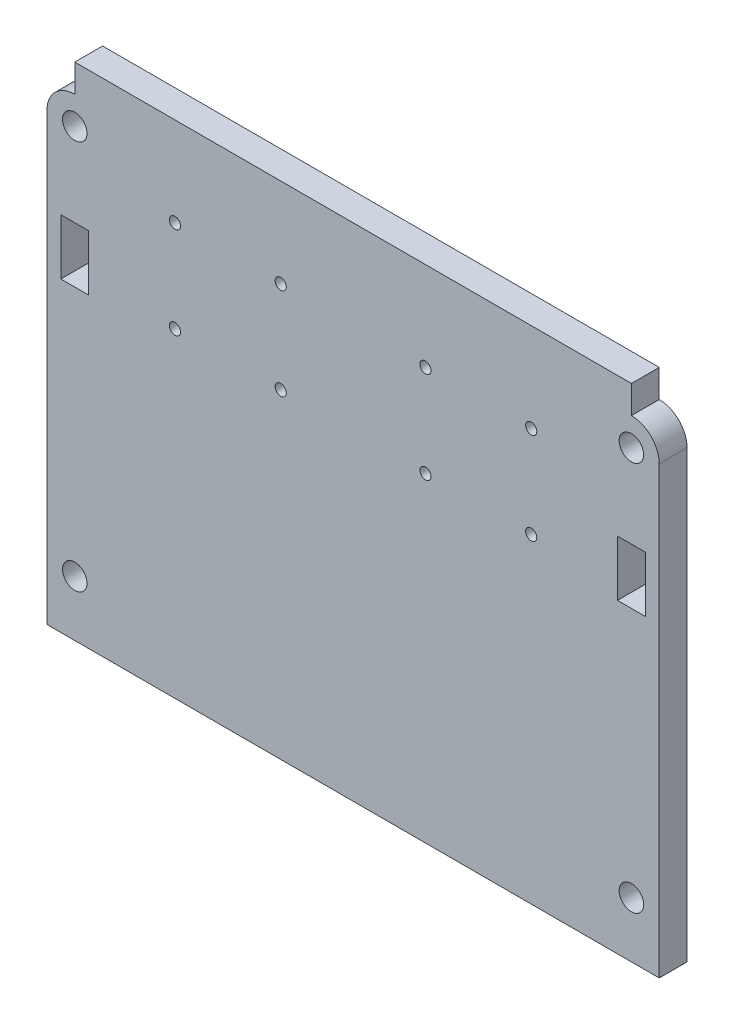
from build123d import *

# Parameters (mm, degrees)
SKETCH1_R           = 2.2
BOSS_EXTRUDE1_DEPTH = 5
SKETCH2_R           = 1
CUT_EXTRUDE1_DEPTH  = 153.151240547


with BuildPart() as part:
    # Sketch1 → Boss-Extrude1 (new body)
    with BuildSketch(Plane.XY):
        with BuildLine():
            Line((0, 105), (0, 110))
            Line((0, 110), (100, 110))
            Line((100, 110), (100, 105))
            ThreePointArc((100, 105), (103.535533906, 103.535533906), (105, 100))
            Line((105, 100), (105, 20))
            Line((105, 20), (100, 20))
            Line((100, 20), (0, 20))
            Line((0, 20), (-5, 20))
            Line((-5, 20), (-5, 100))
            ThreePointArc((-5, 100), (-3.535533906, 103.535533906), (0, 105))
        make_face()
        with Locations((0, 100)):
            Circle(SKETCH1_R, mode=Mode.SUBTRACT)
        with Locations((0, 30)):
            Circle(SKETCH1_R, mode=Mode.SUBTRACT)
        with Locations(Location((100, 30, 0), (0, 0, 180))):
            Circle(SKETCH1_R, mode=Mode.SUBTRACT)
        with Locations(Location((100, 100, 0), (0, 0, 180))):
            Circle(SKETCH1_R, mode=Mode.SUBTRACT)
        Polygon((0, 85), (2.5, 85), (2.5, 75), (0, 75), (-2.5, 75), (-2.5, 85), align=None, mode=Mode.SUBTRACT)
        Polygon((102.5, 75), (100, 75), (97.5, 75), (97.5, 85), (100, 85), (102.5, 85), align=None, mode=Mode.SUBTRACT)
    extrude(amount=BOSS_EXTRUDE1_DEPTH)

    # Sketch2 → Cut-Extrude1 (cut, through all)
    with BuildSketch(Plane.XY.offset(5)):
        with Locations((18, 94)):
            Circle(SKETCH2_R)
        with Locations((37, 94)):
            Circle(SKETCH2_R)
        with Locations((18, 77.5)):
            Circle(SKETCH2_R)
        with Locations((37, 77.5)):
            Circle(SKETCH2_R)
        with Locations(Location((63, 77.5, 0), (0, 0, 180))):
            Circle(SKETCH2_R)
        with Locations(Location((82, 77.5, 0), (0, 0, 180))):
            Circle(SKETCH2_R)
        with Locations(Location((63, 94, 0), (0, 0, 180))):
            Circle(SKETCH2_R)
        with Locations(Location((82, 94, 0), (0, 0, 180))):
            Circle(SKETCH2_R)
    extrude(amount=-CUT_EXTRUDE1_DEPTH, mode=Mode.SUBTRACT)


solid = part.part
